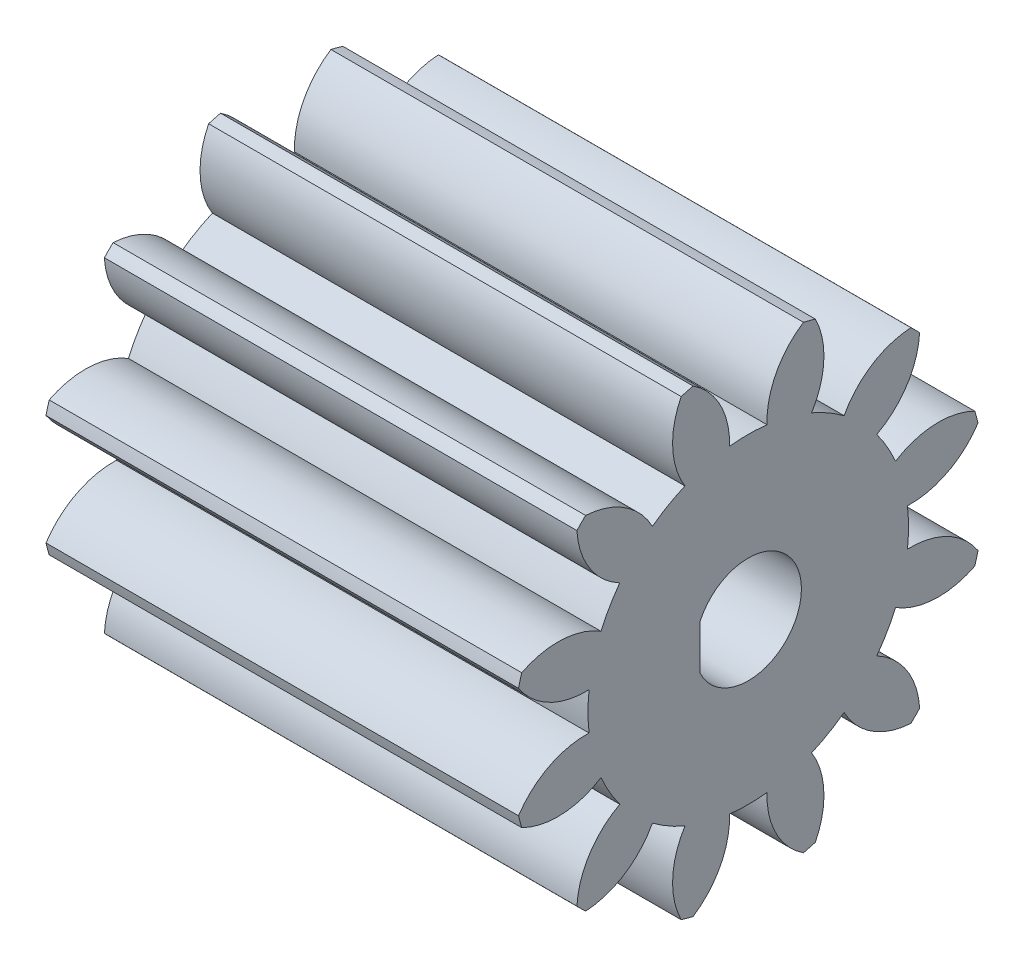
from build123d import *

# Parameters (mm, degrees)
BASPROSKE_W              = 28
BASPROSKE_H              = 14
TOOTHCUT_DEPTH           = 35.292856399
TEETHCUTS_COUNT          = 12
TEETHCUTS_ANGLE          = 330
BORSKE_R                 = 5
BORE_DEPTH               = 50.0000508
KEYSKE_W                 = 4
KEYSKE_H                 = 6.8
KEYWAY_DEPTH             = 50.0000508
RESSALTO_EXTRUS_O1_START = -28
ESBO_O1_R                = 9.499
RESSALTO_EXTRUS_O1_DEPTH = 28
CORTE_EXTRUS_O1_REACH    = 35.98


with BuildPart() as part:
    # BasProSke → Base-Revolve (revolve)
    with BuildSketch(Plane(origin=(0, 0, 0), x_dir=(1, 0, 0), z_dir=(0, 1, 0)), mode=Mode.PRIVATE) as base_revolve_sk:
        with Locations((14, 7)):
            Rectangle(BASPROSKE_W, BASPROSKE_H)
    revolve(base_revolve_sk.sketch.rotate(Axis((-10, 0, 0), (1, 0, 0)), 180), axis=Axis((-10, 0, 0), (1, 0, 0)))

    # TooCutSke → ToothCut (cut, through all)
    with BuildSketch(Plane(origin=(0, 0, 0), x_dir=(0, 0, -1), z_dir=(1, 0, 0))):
        with BuildLine():
            ThreePointArc((1.111908866, 9.433698091), (0, 9.499), (-1.111908866, 9.433698091))
            ThreePointArc((-1.111908866, 9.433698091), (-1.651516138, 11.821129337), (-3.298149691, 13.632096456))
            ThreePointArc((-3.298149691, 13.632096456), (0, 14.0254), (3.298149691, 13.632096456))
            ThreePointArc((3.298149691, 13.632096456), (1.651516138, 11.821129337), (1.111908866, 9.433698091))
        make_face()
    toothcut = extrude(amount=TOOTHCUT_DEPTH, mode=Mode.SUBTRACT)

    # TeethCuts: ToothCut ×12 about axis
    teethcuts_axis = Axis((-10, 0, 0), (1, 0, 0))
    for i in range(1, TEETHCUTS_COUNT):
        add(toothcut.rotate(teethcuts_axis, i * TEETHCUTS_ANGLE / (TEETHCUTS_COUNT - 1)), mode=Mode.SUBTRACT)

    # BorSke → Bore (cut, symmetric)
    with BuildSketch(Plane(origin=(0, 0, 0), x_dir=(0, 0, -1), z_dir=(1, 0, 0))):
        with Locations(Location((0, 0, 0), (0, 0, 180))):
            Circle(BORSKE_R)
    extrude(amount=BORE_DEPTH, both=True, mode=Mode.SUBTRACT)

    # KeySke → Keyway (cut, symmetric)
    with BuildSketch(Plane(origin=(0, 0, 0), x_dir=(0, 0, -1), z_dir=(1, 0, 0))):
        with Locations((0, 3.4)):
            Rectangle(KEYSKE_W, KEYSKE_H)
    extrude(amount=KEYWAY_DEPTH, both=True, mode=Mode.SUBTRACT)

    # Esboço1 → Ressalto-extrusão1 (add)
    with BuildSketch(Plane(origin=(28, 0, 0), x_dir=(0, 0, -1), z_dir=(1, 0, 0)).offset(RESSALTO_EXTRUS_O1_START)):
        Circle(ESBO_O1_R)
    extrude(amount=RESSALTO_EXTRUS_O1_DEPTH)

    # Esboço2 → Corte-extrusão1 (cut, up to next)
    with BuildSketch(Plane(origin=(28, 0, 0), x_dir=(0, 0, -1), z_dir=(1, 0, 0)), mode=Mode.PRIVATE) as corte_extrus_o1_sk1:
        with BuildLine():
            Line((-2.85, 1.341640786), (-2.85, -1.341640786))
            ThreePointArc((-2.85, -1.341640786), (3.15, 0), (-2.85, 1.341640786))
        make_face()
    corte_extrus_o1_tool1 = extrude(corte_extrus_o1_sk1.sketch, amount=-CORTE_EXTRUS_O1_REACH, mode=Mode.PRIVATE) & part.part
    add(corte_extrus_o1_tool1.solids().sort_by_distance((28, 0, -0.052561))[0], mode=Mode.SUBTRACT)


solid = part.part
